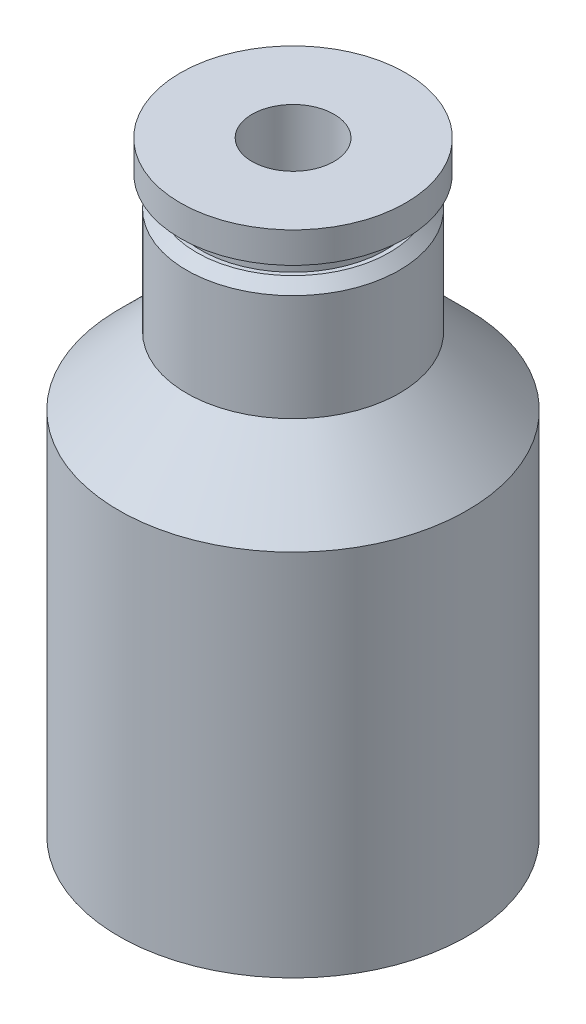
from build123d import *


with BuildPart() as part:
    # Эскиз1 → Повернуть1 (revolve)
    with BuildSketch(Plane.XY, mode=Mode.PRIVATE) as revolve_1_sk:
        Polygon((2, 29.5), (2, 13.044251017), (2, 10), (6, 10), (6, 0), (8.5, 0), (8.5, 18), (5.196152423, 21.303847577), (5.196152423, 26.503847577), (4.7, 27), (4.5, 27), (4.5, 28), (5.5, 28), (5.5, 29.5), align=None)
    revolve(revolve_1_sk.sketch.rotate(Axis((0, 0, 0), (0, 1, 0)), 90), axis=Axis((0, 0, 0), (0, 1, 0)))


solid = part.part
